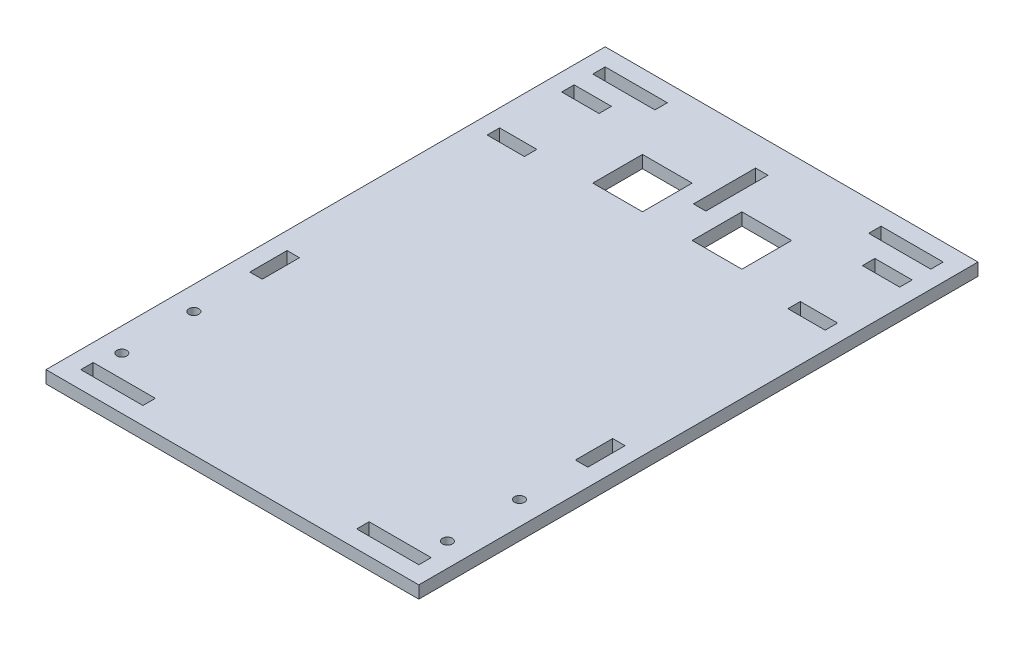
from build123d import *

# Parameters (mm, degrees)
SKETCH1_W           = 150
SKETCH1_H           = 225
BOSS_EXTRUDE1_DEPTH = 5
SKETCH10_W          = 25
SKETCH10_H          = 5
CUT_EXTRUDE5_DEPTH  = 5
SKETCH11_W          = 15
SKETCH11_H          = 5
CUT_EXTRUDE6_DEPTH  = 5
SKETCH12_W          = 5
SKETCH12_H          = 15
CUT_EXTRUDE7_DEPTH  = 5
SKETCH13_R          = 2
CUT_EXTRUDE8_DEPTH  = 5
SKETCH14_W          = 20
SKETCH14_H          = 20
CUT_EXTRUDE9_DEPTH  = 5
SKETCH15_W          = 5
SKETCH15_H          = 25
CUT_EXTRUDE10_DEPTH = 5


with BuildPart() as part:
    # Sketch1 → Boss-Extrude1 (new body)
    with BuildSketch(Plane(origin=(0, 0, 0), x_dir=(1, 0, 0), z_dir=(0, 1, 0))):
        Rectangle(SKETCH1_W, SKETCH1_H)
    extrude(amount=BOSS_EXTRUDE1_DEPTH)

    # Sketch10 → Cut-Extrude5 (cut)
    with BuildSketch(Plane(origin=(0, 5, 0), x_dir=(1, 0, 0), z_dir=(0, 1, 0))):
        with Locations((-55.5, -103)):
            Rectangle(SKETCH10_W, SKETCH10_H)
        with Locations((-55.5, 103)):
            Rectangle(SKETCH10_W, SKETCH10_H)
        with Locations((55.5, -103)):
            Rectangle(SKETCH10_W, SKETCH10_H)
        with Locations((55.5, 103)):
            Rectangle(SKETCH10_W, SKETCH10_H)
    extrude(amount=-CUT_EXTRUDE5_DEPTH, mode=Mode.SUBTRACT)

    # Sketch11 → Cut-Extrude6 (cut)
    with BuildSketch(Plane(origin=(0, 5, 0), x_dir=(1, 0, 0), z_dir=(0, 1, 0))):
        with Locations((-60.5, 90.5)):
            Rectangle(SKETCH11_W, SKETCH11_H)
        with Locations((60.5, 90.5)):
            Rectangle(SKETCH11_W, SKETCH11_H)
        with Locations((-60.5, 60.5)):
            Rectangle(SKETCH11_W, SKETCH11_H)
        with Locations((60.5, 60.5)):
            Rectangle(SKETCH11_W, SKETCH11_H)
    extrude(amount=-CUT_EXTRUDE6_DEPTH, mode=Mode.SUBTRACT)

    # Sketch12 → Cut-Extrude7 (cut)
    with BuildSketch(Plane(origin=(0, 5, 0), x_dir=(1, 0, 0), z_dir=(0, 1, 0))):
        with Locations((-65.5, -30)):
            Rectangle(SKETCH12_W, SKETCH12_H)
        with Locations((65.5, -30)):
            Rectangle(SKETCH12_W, SKETCH12_H)
    extrude(amount=-CUT_EXTRUDE7_DEPTH, mode=Mode.SUBTRACT)

    # Sketch13 → Cut-Extrude8 (cut)
    with BuildSketch(Plane(origin=(0, 5, 0), x_dir=(1, 0, 0), z_dir=(0, 1, 0))):
        with Locations(Location((-65.5, -62.5, 0), (0, 0, 270))):
            Circle(SKETCH13_R)
        with Locations(Location((-65.5, -91.5, 0), (0, 0, 270))):
            Circle(SKETCH13_R)
        with Locations(Location((65.5, -91.5, 0), (0, 0, 270))):
            Circle(SKETCH13_R)
        with Locations(Location((65.5, -62.5, 0), (0, 0, 270))):
            Circle(SKETCH13_R)
    extrude(amount=-CUT_EXTRUDE8_DEPTH, mode=Mode.SUBTRACT)

    # Sketch14 → Cut-Extrude9 (cut)
    with BuildSketch(Plane(origin=(0, 5, 0), x_dir=(1, 0, 0), z_dir=(0, 1, 0))):
        with Locations((20, 72.5)):
            Rectangle(SKETCH14_W, SKETCH14_H)
        with Locations((-20, 72.5)):
            Rectangle(SKETCH14_W, SKETCH14_H)
    extrude(amount=-CUT_EXTRUDE9_DEPTH, mode=Mode.SUBTRACT)

    # Sketch15 → Cut-Extrude10 (cut)
    with BuildSketch(Plane(origin=(0, 5, 0), x_dir=(1, 0, 0), z_dir=(0, 1, 0))):
        with Locations((0, 88)):
            Rectangle(SKETCH15_W, SKETCH15_H)
    extrude(amount=-CUT_EXTRUDE10_DEPTH, mode=Mode.SUBTRACT)


solid = part.part
